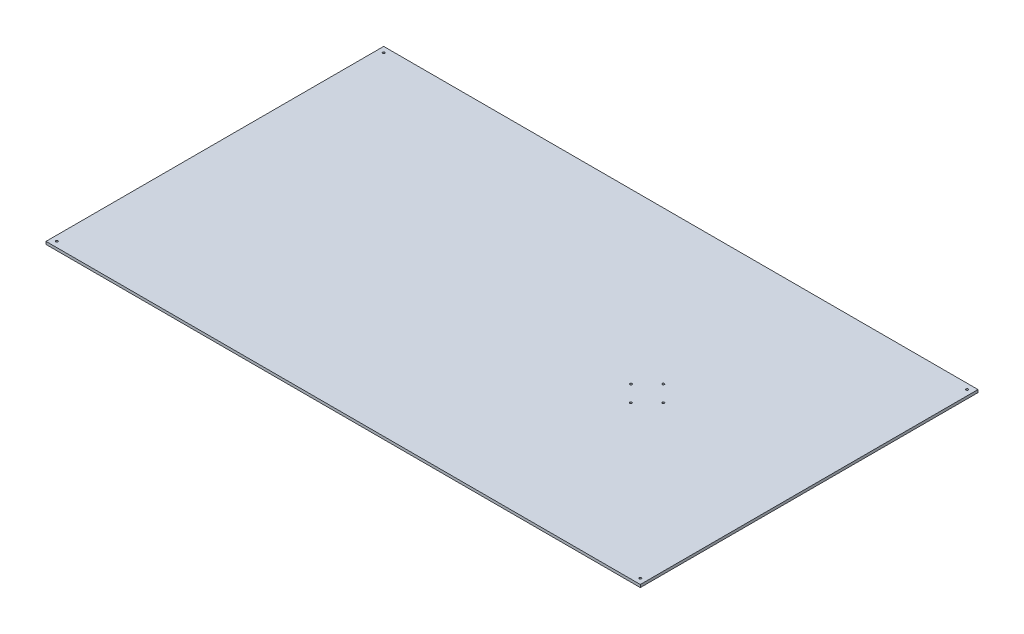
from build123d import *

# Parameters (mm, degrees)
SKETCH_2_W      = 2200
SKETCH_2_H      = 1250
EXTRUDE_1_DEPTH = 10
MM_1_D          = 8
MM_1_DEPTH      = 20
MM_1_TIP        = 2.403442476
MM_2_D          = 8
MM_2_DEPTH      = 20
MM_2_TIP        = 2.403442476


with BuildPart() as part:
    # 草图2 → 凸台-拉伸1 (new body)
    with BuildSketch(Plane(origin=(0, 0, 0), x_dir=(1, 0, 0), z_dir=(0, 1, 0))):
        Rectangle(SKETCH_2_W, SKETCH_2_H)
    extrude(amount=EXTRUDE_1_DEPTH)

    # 大小mm 暗销孔1
    with Locations(Plane(origin=(-1080, 10, -605), x_dir=(0, 0, 1), z_dir=(0, 1, 0))):
        with Locations((0, 0), (0, 2160), (1210, 2160), (1210, 0)):
            Hole(MM_1_D / 2, depth=MM_1_DEPTH)
            with Locations((0, 0, -(MM_1_DEPTH + MM_1_TIP / 2))):  # 118° drill point
                Cone(0, MM_1_D / 2, MM_1_TIP, mode=Mode.SUBTRACT)

    # 大小mm 暗销孔2
    with Locations(Plane(origin=(500, 10, -60), x_dir=(0, 0, 1), z_dir=(0, 1, 0))):
        with Locations((0, 0), (60, -60), (120, 0), (60, 60)):
            Hole(MM_2_D / 2, depth=MM_2_DEPTH)
            with Locations((0, 0, -(MM_2_DEPTH + MM_2_TIP / 2))):  # 118° drill point
                Cone(0, MM_2_D / 2, MM_2_TIP, mode=Mode.SUBTRACT)


solid = part.part
